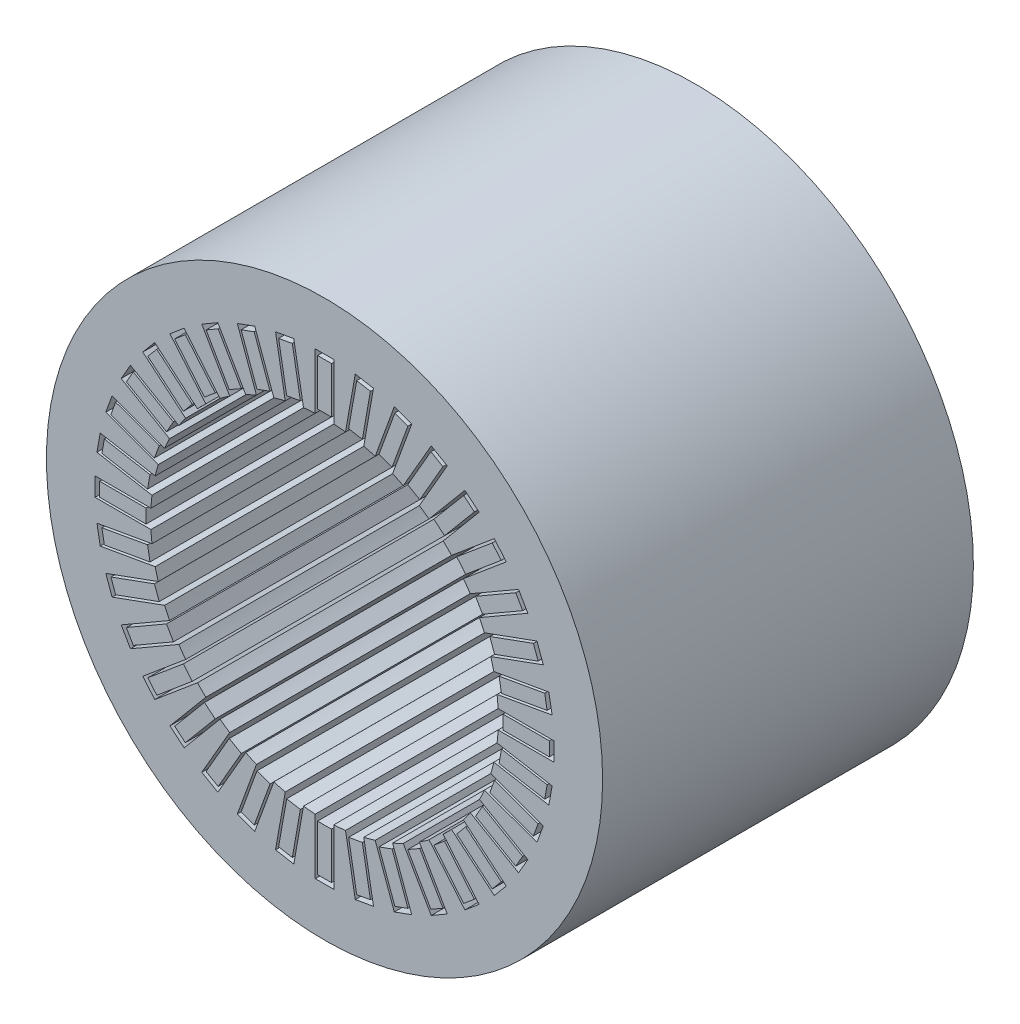
from build123d import *

# Parameters (mm, degrees)
SKETCH1_R         = 60
SKETCH1_R_2       = 37.5
NUCLEO_DEPTH      = 80
SKETCH5_W         = 12.5
SKETCH5_H         = 4
RANURA_DEPTH      = 117.619037897
RANURAS_X36_COUNT = 36
SKETCH6_W         = 10
SKETCH6_H         = 3
BOBINA_DEPTH      = 80
BOBINAS_X36_COUNT = 36


with BuildPart() as part:
    # Sketch1 → Nucleo (new body)
    with BuildSketch(Plane.XY):
        Circle(SKETCH1_R)
        Circle(SKETCH1_R_2, mode=Mode.SUBTRACT)
    extrude(amount=NUCLEO_DEPTH)

    # Sketch5 → Ranura (cut, through all)
    with BuildSketch(Plane.XY):
        with Locations((43.25, 0)):
            Rectangle(SKETCH5_W, SKETCH5_H)
    ranura = extrude(amount=RANURA_DEPTH, mode=Mode.SUBTRACT)

    # Ranuras_x36: Ranura ×36 about axis
    ranuras_x36_axis = Axis((0, 0, 0), (0, 0, 1))
    for i in range(1, RANURAS_X36_COUNT):
        add(ranura.rotate(ranuras_x36_axis, i * 360 / RANURAS_X36_COUNT), mode=Mode.SUBTRACT)


with BuildPart() as body_2:
    # Sketch6 → Bobina (new body)
    with BuildSketch(Plane.XY):
        with Locations((43.5, 0)):
            Rectangle(SKETCH6_W, SKETCH6_H)
    extrude(amount=BOBINA_DEPTH)


with BuildPart() as bobinas_x36_1:
    # Bobinas_x36: pattern copy
    add(body_2.part.rotate(Axis((0, 0, 0), (0, 0, 1)), 1 * 360 / BOBINAS_X36_COUNT))


with BuildPart() as bobinas_x36_2:
    # Bobinas_x36: pattern copy
    add(body_2.part.rotate(Axis((0, 0, 0), (0, 0, 1)), 2 * 360 / BOBINAS_X36_COUNT))


with BuildPart() as bobinas_x36_3:
    # Bobinas_x36: pattern copy
    add(body_2.part.rotate(Axis((0, 0, 0), (0, 0, 1)), 3 * 360 / BOBINAS_X36_COUNT))


with BuildPart() as bobinas_x36_4:
    # Bobinas_x36: pattern copy
    add(body_2.part.rotate(Axis((0, 0, 0), (0, 0, 1)), 4 * 360 / BOBINAS_X36_COUNT))


with BuildPart() as bobinas_x36_5:
    # Bobinas_x36: pattern copy
    add(body_2.part.rotate(Axis((0, 0, 0), (0, 0, 1)), 5 * 360 / BOBINAS_X36_COUNT))


with BuildPart() as bobinas_x36_6:
    # Bobinas_x36: pattern copy
    add(body_2.part.rotate(Axis((0, 0, 0), (0, 0, 1)), 6 * 360 / BOBINAS_X36_COUNT))


with BuildPart() as bobinas_x36_7:
    # Bobinas_x36: pattern copy
    add(body_2.part.rotate(Axis((0, 0, 0), (0, 0, 1)), 7 * 360 / BOBINAS_X36_COUNT))


with BuildPart() as bobinas_x36_8:
    # Bobinas_x36: pattern copy
    add(body_2.part.rotate(Axis((0, 0, 0), (0, 0, 1)), 8 * 360 / BOBINAS_X36_COUNT))


with BuildPart() as bobinas_x36_9:
    # Bobinas_x36: pattern copy
    add(body_2.part.rotate(Axis((0, 0, 0), (0, 0, 1)), 9 * 360 / BOBINAS_X36_COUNT))


with BuildPart() as bobinas_x36_10:
    # Bobinas_x36: pattern copy
    add(body_2.part.rotate(Axis((0, 0, 0), (0, 0, 1)), 10 * 360 / BOBINAS_X36_COUNT))


with BuildPart() as bobinas_x36_11:
    # Bobinas_x36: pattern copy
    add(body_2.part.rotate(Axis((0, 0, 0), (0, 0, 1)), 11 * 360 / BOBINAS_X36_COUNT))


with BuildPart() as bobinas_x36_12:
    # Bobinas_x36: pattern copy
    add(body_2.part.rotate(Axis((0, 0, 0), (0, 0, 1)), 12 * 360 / BOBINAS_X36_COUNT))


with BuildPart() as bobinas_x36_13:
    # Bobinas_x36: pattern copy
    add(body_2.part.rotate(Axis((0, 0, 0), (0, 0, 1)), 13 * 360 / BOBINAS_X36_COUNT))


with BuildPart() as bobinas_x36_14:
    # Bobinas_x36: pattern copy
    add(body_2.part.rotate(Axis((0, 0, 0), (0, 0, 1)), 14 * 360 / BOBINAS_X36_COUNT))


with BuildPart() as bobinas_x36_15:
    # Bobinas_x36: pattern copy
    add(body_2.part.rotate(Axis((0, 0, 0), (0, 0, 1)), 15 * 360 / BOBINAS_X36_COUNT))


with BuildPart() as bobinas_x36_16:
    # Bobinas_x36: pattern copy
    add(body_2.part.rotate(Axis((0, 0, 0), (0, 0, 1)), 16 * 360 / BOBINAS_X36_COUNT))


with BuildPart() as bobinas_x36_17:
    # Bobinas_x36: pattern copy
    add(body_2.part.rotate(Axis((0, 0, 0), (0, 0, 1)), 17 * 360 / BOBINAS_X36_COUNT))


with BuildPart() as bobinas_x36_18:
    # Bobinas_x36: pattern copy
    add(body_2.part.rotate(Axis((0, 0, 0), (0, 0, 1)), 18 * 360 / BOBINAS_X36_COUNT))


with BuildPart() as bobinas_x36_19:
    # Bobinas_x36: pattern copy
    add(body_2.part.rotate(Axis((0, 0, 0), (0, 0, 1)), 19 * 360 / BOBINAS_X36_COUNT))


with BuildPart() as bobinas_x36_20:
    # Bobinas_x36: pattern copy
    add(body_2.part.rotate(Axis((0, 0, 0), (0, 0, 1)), 20 * 360 / BOBINAS_X36_COUNT))


with BuildPart() as bobinas_x36_21:
    # Bobinas_x36: pattern copy
    add(body_2.part.rotate(Axis((0, 0, 0), (0, 0, 1)), 21 * 360 / BOBINAS_X36_COUNT))


with BuildPart() as bobinas_x36_22:
    # Bobinas_x36: pattern copy
    add(body_2.part.rotate(Axis((0, 0, 0), (0, 0, 1)), 22 * 360 / BOBINAS_X36_COUNT))


with BuildPart() as bobinas_x36_23:
    # Bobinas_x36: pattern copy
    add(body_2.part.rotate(Axis((0, 0, 0), (0, 0, 1)), 23 * 360 / BOBINAS_X36_COUNT))


with BuildPart() as bobinas_x36_24:
    # Bobinas_x36: pattern copy
    add(body_2.part.rotate(Axis((0, 0, 0), (0, 0, 1)), 24 * 360 / BOBINAS_X36_COUNT))


with BuildPart() as bobinas_x36_25:
    # Bobinas_x36: pattern copy
    add(body_2.part.rotate(Axis((0, 0, 0), (0, 0, 1)), 25 * 360 / BOBINAS_X36_COUNT))


with BuildPart() as bobinas_x36_26:
    # Bobinas_x36: pattern copy
    add(body_2.part.rotate(Axis((0, 0, 0), (0, 0, 1)), 26 * 360 / BOBINAS_X36_COUNT))


with BuildPart() as bobinas_x36_27:
    # Bobinas_x36: pattern copy
    add(body_2.part.rotate(Axis((0, 0, 0), (0, 0, 1)), 27 * 360 / BOBINAS_X36_COUNT))


with BuildPart() as bobinas_x36_28:
    # Bobinas_x36: pattern copy
    add(body_2.part.rotate(Axis((0, 0, 0), (0, 0, 1)), 28 * 360 / BOBINAS_X36_COUNT))


with BuildPart() as bobinas_x36_29:
    # Bobinas_x36: pattern copy
    add(body_2.part.rotate(Axis((0, 0, 0), (0, 0, 1)), 29 * 360 / BOBINAS_X36_COUNT))


with BuildPart() as bobinas_x36_30:
    # Bobinas_x36: pattern copy
    add(body_2.part.rotate(Axis((0, 0, 0), (0, 0, 1)), 30 * 360 / BOBINAS_X36_COUNT))


with BuildPart() as bobinas_x36_31:
    # Bobinas_x36: pattern copy
    add(body_2.part.rotate(Axis((0, 0, 0), (0, 0, 1)), 31 * 360 / BOBINAS_X36_COUNT))


with BuildPart() as bobinas_x36_32:
    # Bobinas_x36: pattern copy
    add(body_2.part.rotate(Axis((0, 0, 0), (0, 0, 1)), 32 * 360 / BOBINAS_X36_COUNT))


with BuildPart() as bobinas_x36_33:
    # Bobinas_x36: pattern copy
    add(body_2.part.rotate(Axis((0, 0, 0), (0, 0, 1)), 33 * 360 / BOBINAS_X36_COUNT))


with BuildPart() as bobinas_x36_34:
    # Bobinas_x36: pattern copy
    add(body_2.part.rotate(Axis((0, 0, 0), (0, 0, 1)), 34 * 360 / BOBINAS_X36_COUNT))


with BuildPart() as bobinas_x36_35:
    # Bobinas_x36: pattern copy
    add(body_2.part.rotate(Axis((0, 0, 0), (0, 0, 1)), 35 * 360 / BOBINAS_X36_COUNT))


solid = Compound([part.part, body_2.part, bobinas_x36_1.part, bobinas_x36_2.part, bobinas_x36_3.part, bobinas_x36_4.part, bobinas_x36_5.part, bobinas_x36_6.part, bobinas_x36_7.part, bobinas_x36_8.part, bobinas_x36_9.part, bobinas_x36_10.part, bobinas_x36_11.part, bobinas_x36_12.part, bobinas_x36_13.part, bobinas_x36_14.part, bobinas_x36_15.part, bobinas_x36_16.part, bobinas_x36_17.part, bobinas_x36_18.part, bobinas_x36_19.part, bobinas_x36_20.part, bobinas_x36_21.part, bobinas_x36_22.part, bobinas_x36_23.part, bobinas_x36_24.part, bobinas_x36_25.part, bobinas_x36_26.part, bobinas_x36_27.part, bobinas_x36_28.part, bobinas_x36_29.part, bobinas_x36_30.part, bobinas_x36_31.part, bobinas_x36_32.part, bobinas_x36_33.part, bobinas_x36_34.part, bobinas_x36_35.part])
